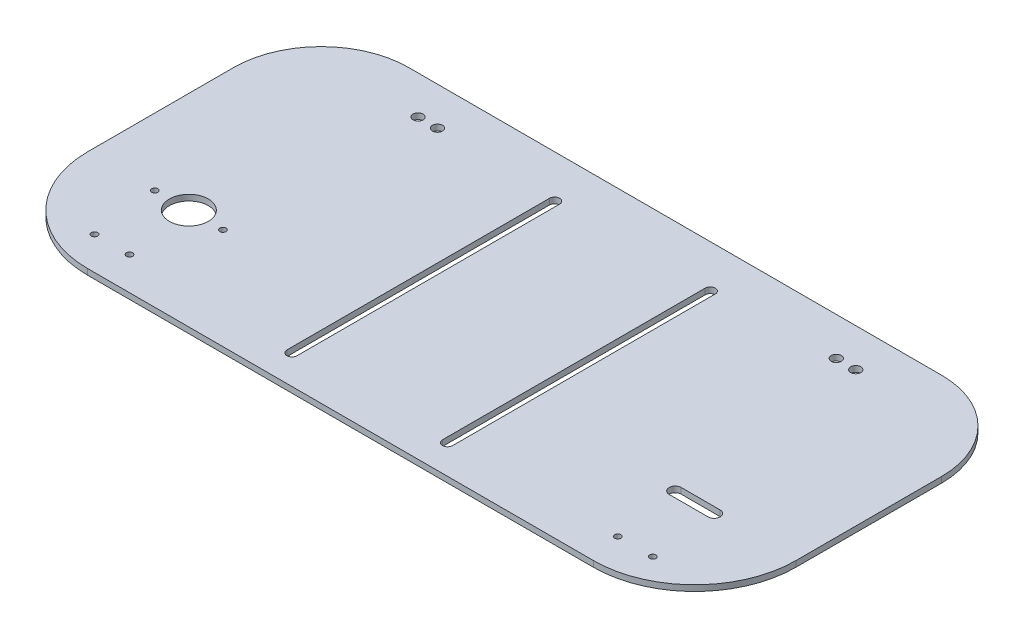
from build123d import *

# Parameters (mm, degrees)
SKETCH1_R           = 3.1
BOSS_EXTRUDE1_DEPTH = 3
CUT_EXTRUDE1_DEPTH  = 335.294780097
FILLET1_R           = 45
SKETCH3_R           = 10
CUT_EXTRUDE2_DEPTH  = 335.294780097
SKETCH4_R           = 2.6
CUT_EXTRUDE3_DEPTH  = 335.294780097
SKETCH5_R           = 1.6
CUT_EXTRUDE4_DEPTH  = 335.294780097
SKETCH6_R           = 1.6
CUT_EXTRUDE5_DEPTH  = 335.294780097


with BuildPart() as part:
    # Sketch1 → Boss-Extrude1 (new body)
    # profile 1 of 2: a face of its own
    with BuildSketch(Plane(origin=(0, 0, 0), x_dir=(1, 0, 0), z_dir=(0, 1, 0))):
        with BuildLine():
            Line((0, -52), (260, -52))
            ThreePointArc((260, -52), (312, 0), (260, 52))
            Line((260, 52), (0, 52))
            ThreePointArc((0, 52), (-52, 0), (0, -52))
        make_face()
        with Locations(Location((0, 0, 0), (0, 0, 270))):
            Circle(SKETCH1_R, mode=Mode.SUBTRACT)
        with BuildLine():
            ThreePointArc((250, 3.1), (246.9, 0), (250, -3.1))
            Line((250, -3.1), (270, -3.1))
            ThreePointArc((270, -3.1), (273.1, 0), (270, 3.1))
            Line((270, 3.1), (250, 3.1))
        make_face(mode=Mode.SUBTRACT)
    # profile 2 of 2: a face of its own
    with BuildSketch(Plane(origin=(0, 0, 0), x_dir=(1, 0, 0), z_dir=(0, 1, 0))):
        with BuildLine():
            ThreePointArc((-52, 0), (-36.769552622, 36.769552622), (0, 52))
            Line((0, 52), (260, 52))
            ThreePointArc((260, 52), (296.769552622, 36.769552622), (312, 0))
            Line((312, 0), (312, 120))
            Line((312, 120), (-52, 120))
            Line((-52, 120), (-52, 0))
        make_face()
    extrude(amount=BOSS_EXTRUDE1_DEPTH)

    # Sketch2 → Cut-Extrude1 (cut, through all)
    with BuildSketch(Plane(origin=(0, 3, 0), x_dir=(1, 0, 0), z_dir=(0, 1, 0))):
        with BuildLine():
            Line((87.4, -37), (87.4, 98))
            ThreePointArc((87.4, 98), (90, 100.6), (92.6, 98))
            Line((92.6, 98), (92.6, -37))
            ThreePointArc((92.6, -37), (90, -39.6), (87.4, -37))
        make_face()
        with BuildLine():
            Line((172.6, -37), (172.6, 98))
            ThreePointArc((172.6, 98), (170, 100.6), (167.4, 98))
            Line((167.4, 98), (167.4, -37))
            ThreePointArc((167.4, -37), (170, -39.6), (172.6, -37))
        make_face()
    extrude(amount=-CUT_EXTRUDE1_DEPTH, mode=Mode.SUBTRACT)

    # Fillet1
    fillet1_edges = [part.edges().sort_by_distance(p)[0] for p in [
        (-52, 1.5, -120),
        (312, 1.5, -120),
    ]]
    fillet(fillet1_edges, radius=FILLET1_R)

    # Sketch3 → Cut-Extrude2 (cut, through all)
    with BuildSketch(Plane(origin=(0, 3, 0), x_dir=(1, 0, 0), z_dir=(0, 1, 0))):
        with Locations(Location((0, 0, 0), (0, 0, 270))):
            Circle(SKETCH3_R)
    extrude(amount=-CUT_EXTRUDE2_DEPTH, mode=Mode.SUBTRACT)

    # Sketch4 → Cut-Extrude3 (cut, through all)
    with BuildSketch(Plane.XZ):
        with Locations(Location((17.4, -100.4, 0), (0, 0, 270))):
            Circle(SKETCH4_R)
        with Locations(Location((27.4, -100.4, 0), (0, 0, 270))):
            Circle(SKETCH4_R)
        with Locations(Location((232.4, -100.4, 0), (0, 0, 270))):
            Circle(SKETCH4_R)
        with Locations(Location((242.4, -100.4, 0), (0, 0, 270))):
            Circle(SKETCH4_R)
    extrude(amount=-CUT_EXTRUDE3_DEPTH, mode=Mode.SUBTRACT)

    # Sketch5 → Cut-Extrude4 (cut, through all)
    with BuildSketch(Plane(origin=(0, 3, 0), x_dir=(1, 0, 0), z_dir=(0, 1, 0))):
        with Locations(Location((-17.5, 0, 0), (0, 0, 270))):
            Circle(SKETCH5_R)
        with Locations(Location((17.5, 0, 0), (0, 0, 270))):
            Circle(SKETCH5_R)
    extrude(amount=-CUT_EXTRUDE4_DEPTH, mode=Mode.SUBTRACT)

    # Sketch6 → Cut-Extrude5 (cut, through all)
    with BuildSketch(Plane(origin=(0, 3, 0), x_dir=(1, 0, 0), z_dir=(0, 1, 0))):
        with Locations(Location((-13.5, -35, 0), (0, 0, 270))):
            Circle(SKETCH6_R)
        with Locations(Location((4.5, -35, 0), (0, 0, 270))):
            Circle(SKETCH6_R)
        with Locations(Location((255.5, -35, 0), (0, 0, 270))):
            Circle(SKETCH6_R)
        with Locations(Location((273.5, -35, 0), (0, 0, 270))):
            Circle(SKETCH6_R)
    extrude(amount=-CUT_EXTRUDE5_DEPTH, mode=Mode.SUBTRACT)


solid = part.part
